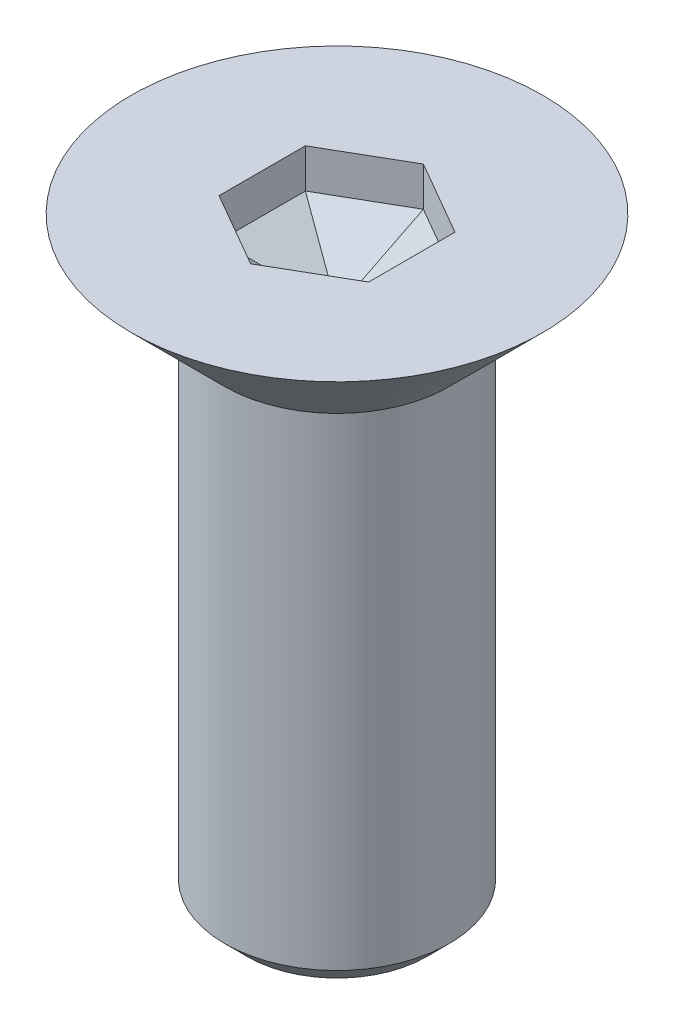
from build123d import *
from OCP.BRepFilletAPI import BRepFilletAPI_MakeChamfer

# Parameters (mm, degrees)
SKETCH_4_R          = 1.5
EXTRUDE_2_DEPTH     = 8
CUT_EXTRUDE_1_DEPTH = 1.1
CHAMFER_3_SIZE      = 0.576368876
CHAMFER_3_SIZE2     = 0.998300177
CHAMFER_4_SIZE      = 0.3


with BuildPart() as part:
    # 草图2 → 旋转1 (revolve)
    with BuildSketch(Plane.XY):
        Polygon((0, -1.86), (0, 0), (2.75, 0), (0.89, -1.86), align=None)
    revolve(axis=Axis((0, -1.86, 0), (0, 1, 0)))

    # 草图4 → 凸台-拉伸2 (add)
    with BuildSketch(Plane.XZ):
        Circle(SKETCH_4_R)
    extrude(amount=EXTRUDE_2_DEPTH)

    # 草图3 → 切除-拉伸1 (cut)
    with BuildSketch(Plane(origin=(0, 0, 0), x_dir=(1, 0, 0), z_dir=(0, 1, 0))):
        Polygon((1, 0.577350269), (0, 1.154700538), (-1, 0.577350269), (-1, -0.577350269), (0, -1.154700538), (1, -0.577350269), align=None)
    extrude(amount=-CUT_EXTRUDE_1_DEPTH, mode=Mode.SUBTRACT)

    # 倒角3: one chamfer whose edges measure the first distance from different faces: ONE call of the kernel's chamfer builder (chamfer() names one face for all edges)
    chamfer_3_edges_1 = [part.edges().sort_by_distance(p)[0] for p in [
        (-0.5, -1.1, 0.866025404),
    ]]
    chamfer_3_side_1 = [part.faces().sort_by_distance(p)[0] for p in [
        (-0.5, -0.55, 0.866025404),
    ]]
    chamfer_3_edges_2 = [part.edges().sort_by_distance(p)[0] for p in [
        (-1, -1.1, 0),
    ]]
    chamfer_3_side_2 = [part.faces().sort_by_distance(p)[0] for p in [
        (-1, -0.55, 0),
    ]]
    chamfer_3_edges_3 = [part.edges().sort_by_distance(p)[0] for p in [
        (-0.5, -1.1, -0.866025404),
    ]]
    chamfer_3_side_3 = [part.faces().sort_by_distance(p)[0] for p in [
        (-0.5, -0.55, -0.866025404),
    ]]
    chamfer_3_edges_4 = [part.edges().sort_by_distance(p)[0] for p in [
        (0.5, -1.1, -0.866025404),
    ]]
    chamfer_3_side_4 = [part.faces().sort_by_distance(p)[0] for p in [
        (0.5, -0.55, -0.866025404),
    ]]
    chamfer_3_edges_5 = [part.edges().sort_by_distance(p)[0] for p in [
        (1, -1.1, 0),
    ]]
    chamfer_3_side_5 = [part.faces().sort_by_distance(p)[0] for p in [
        (1, -0.55, 0),
    ]]
    chamfer_3_edges_6 = [part.edges().sort_by_distance(p)[0] for p in [
        (0.5, -1.1, 0.866025404),
    ]]
    chamfer_3_side_6 = [part.faces().sort_by_distance(p)[0] for p in [
        (0.5, -0.55, 0.866025404),
    ]]
    chamfer_3 = BRepFilletAPI_MakeChamfer(part.part.solid().wrapped)
    for e in chamfer_3_edges_1:
        chamfer_3.Add(CHAMFER_3_SIZE, CHAMFER_3_SIZE2, e.wrapped, chamfer_3_side_1[0].wrapped)  # the first distance lies on this face
    for e in chamfer_3_edges_2:
        chamfer_3.Add(CHAMFER_3_SIZE, CHAMFER_3_SIZE2, e.wrapped, chamfer_3_side_2[0].wrapped)  # the first distance lies on this face
    for e in chamfer_3_edges_3:
        chamfer_3.Add(CHAMFER_3_SIZE, CHAMFER_3_SIZE2, e.wrapped, chamfer_3_side_3[0].wrapped)  # the first distance lies on this face
    for e in chamfer_3_edges_4:
        chamfer_3.Add(CHAMFER_3_SIZE, CHAMFER_3_SIZE2, e.wrapped, chamfer_3_side_4[0].wrapped)  # the first distance lies on this face
    for e in chamfer_3_edges_5:
        chamfer_3.Add(CHAMFER_3_SIZE, CHAMFER_3_SIZE2, e.wrapped, chamfer_3_side_5[0].wrapped)  # the first distance lies on this face
    for e in chamfer_3_edges_6:
        chamfer_3.Add(CHAMFER_3_SIZE, CHAMFER_3_SIZE2, e.wrapped, chamfer_3_side_6[0].wrapped)  # the first distance lies on this face
    add(Compound.cast(chamfer_3.Shape()), mode=Mode.REPLACE)

    # 倒角4
    chamfer_4_edges = [part.edges().sort_by_distance(p)[0] for p in [
        (-1.5, -8, 0),
    ]]
    chamfer(chamfer_4_edges, length=CHAMFER_4_SIZE)


solid = part.part
